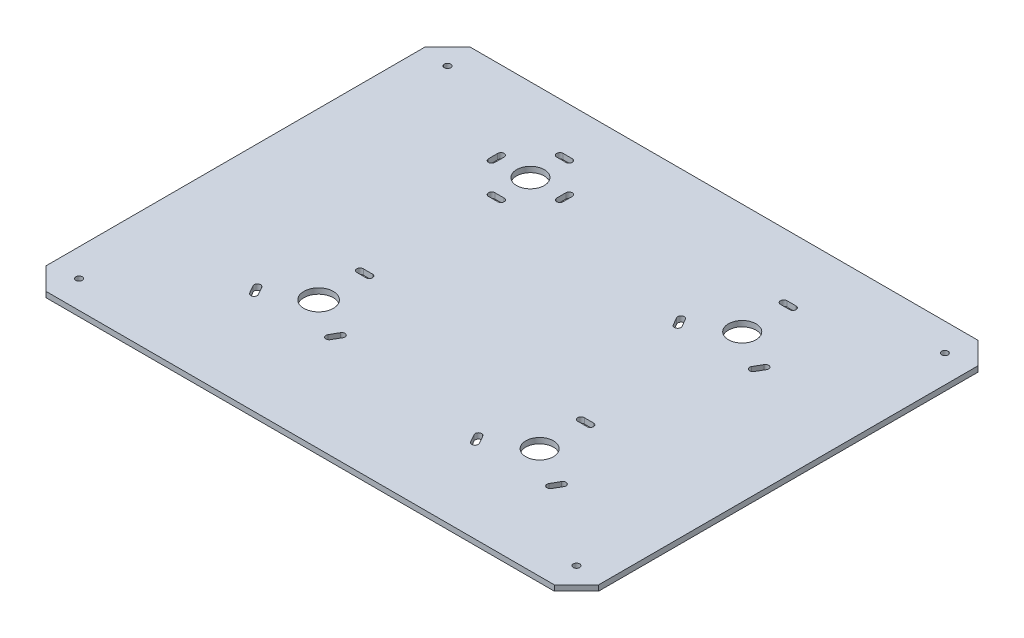
from build123d import *

# Parameters (mm, degrees)
ESBO_O1_W                 = 300
ESBO_O1_H                 = 230
RESSALTO_EXTRUS_O1_DEPTH  = 3
CHANFRO1_SIZE             = 12
ESBO_O4_R                 = 8
ESBO_O4_R_2               = 7.5
CORTE_EXTRUS_O1_DEPTH     = 190.034388406
ESBO_O5_R                 = 1.75
CORTE_EXTRUS_O2_DEPTH     = 190.034388406
ESPELHAR2_COPY_1_SKETCH_R = 1.75
ESPELHAR2_COPY_1_DEPTH    = 190.034388406


with BuildPart() as part:
    # Esboço1 → Ressalto-extrusão1 (new body)
    with BuildSketch(Plane(origin=(0, 0, 0), x_dir=(1, 0, 0), z_dir=(0, 1, 0))):
        Rectangle(ESBO_O1_W, ESBO_O1_H)
    extrude(amount=-RESSALTO_EXTRUS_O1_DEPTH)

    # Chanfro1
    chanfro1_edges = [part.edges().sort_by_distance(p)[0] for p in [
        (150, -1.5, 115),
        (-150, -1.5, 115),
        (-150, -1.5, -115),
        (150, -1.5, -115),
    ]]
    chamfer(chanfro1_edges, length=CHANFRO1_SIZE)

    # Esboço4 → Corte-extrusão1 (cut, through all)
    with BuildSketch(Plane(origin=(0, 0, 0), x_dir=(1, 0, 0), z_dir=(0, 1, 0))):
        with Locations(Location((-60, -45, 0), (0, 0, 270))):
            Circle(ESBO_O4_R)
        with Locations(Location((70, -55, 0), (0, 0, 270))):
            Circle(ESBO_O4_R_2)
        with Locations(Location((70, 55, 0), (0, 0, 270))):
            Circle(ESBO_O4_R_2)
        with Locations(Location((-60, 70, 0), (0, 0, 270))):
            Circle(ESBO_O4_R_2)
        with BuildLine():
            Line((-62.5, -21.75), (-57.5, -21.75))
            ThreePointArc((-57.5, -21.75), (-55.75, -20), (-57.5, -18.25))
            Line((-57.5, -18.25), (-62.5, -18.25))
            ThreePointArc((-62.5, -18.25), (-64.25, -20), (-62.5, -21.75))
        make_face()
        with BuildLine():
            Line((-38.614909362, -54.459936491), (-41.114909362, -58.790063509))
            ThreePointArc((-41.114909362, -58.790063509), (-40.474364905, -61.180607966), (-38.083820449, -60.540063509))
            Line((-38.083820449, -60.540063509), (-35.583820449, -56.209936491))
            ThreePointArc((-35.583820449, -56.209936491), (-36.224364905, -53.819392034), (-38.614909362, -54.459936491))
        make_face()
        with BuildLine():
            Line((-78.885090638, -58.790063509), (-81.385090638, -54.459936491))
            ThreePointArc((-81.385090638, -54.459936491), (-83.775635095, -53.819392034), (-84.416179551, -56.209936491))
            Line((-84.416179551, -56.209936491), (-81.916179551, -60.540063509))
            ThreePointArc((-81.916179551, -60.540063509), (-79.525635095, -61.180607966), (-78.885090638, -58.790063509))
        make_face()
        with BuildLine():
            Line((67.5, -28.25), (72.5, -28.25))
            ThreePointArc((72.5, -28.25), (74.25, -30), (72.5, -31.75))
            Line((72.5, -31.75), (67.5, -31.75))
            ThreePointArc((67.5, -31.75), (65.75, -30), (67.5, -28.25))
        make_face()
        with BuildLine():
            Line((91.385090638, -64.459936491), (88.885090638, -68.790063509))
            ThreePointArc((88.885090638, -68.790063509), (89.525635095, -71.180607966), (91.916179551, -70.540063509))
            Line((91.916179551, -70.540063509), (94.416179551, -66.209936491))
            ThreePointArc((94.416179551, -66.209936491), (93.775635095, -63.819392034), (91.385090638, -64.459936491))
        make_face()
        with BuildLine():
            Line((51.114909362, -68.790063509), (48.614909362, -64.459936491))
            ThreePointArc((48.614909362, -64.459936491), (46.224364905, -63.819392034), (45.583820449, -66.209936491))
            Line((45.583820449, -66.209936491), (48.083820449, -70.540063509))
            ThreePointArc((48.083820449, -70.540063509), (50.474364905, -71.180607966), (51.114909362, -68.790063509))
        make_face()
        with BuildLine():
            Line((67.5, 81.75), (72.5, 81.75))
            ThreePointArc((72.5, 81.75), (74.25, 80), (72.5, 78.25))
            Line((72.5, 78.25), (67.5, 78.25))
            ThreePointArc((67.5, 78.25), (65.75, 80), (67.5, 81.75))
        make_face()
        with BuildLine():
            Line((91.385090638, 45.540063509), (88.885090638, 41.209936491))
            ThreePointArc((88.885090638, 41.209936491), (89.525635095, 38.819392034), (91.916179551, 39.459936491))
            Line((91.916179551, 39.459936491), (94.416179551, 43.790063509))
            ThreePointArc((94.416179551, 43.790063509), (93.775635095, 46.180607966), (91.385090638, 45.540063509))
        make_face()
        with BuildLine():
            Line((51.114909362, 41.209936491), (48.614909362, 45.540063509))
            ThreePointArc((48.614909362, 45.540063509), (46.224364905, 46.180607966), (45.583820449, 43.790063509))
            Line((45.583820449, 43.790063509), (48.083820449, 39.459936491))
            ThreePointArc((48.083820449, 39.459936491), (50.474364905, 38.819392034), (51.114909362, 41.209936491))
        make_face()
        with BuildLine():
            Line((-62.5, 86.75), (-57.5, 86.75))
            ThreePointArc((-57.5, 86.75), (-55.75, 88.5), (-57.5, 90.25))
            Line((-57.5, 90.25), (-62.5, 90.25))
            ThreePointArc((-62.5, 90.25), (-64.25, 88.5), (-62.5, 86.75))
        make_face()
        with BuildLine():
            Line((-43.25, 72.5), (-43.25, 67.5))
            ThreePointArc((-43.25, 67.5), (-41.5, 65.75), (-39.75, 67.5))
            Line((-39.75, 67.5), (-39.75, 72.5))
            ThreePointArc((-39.75, 72.5), (-41.5, 74.25), (-43.25, 72.5))
        make_face()
        with BuildLine():
            Line((-57.5, 53.25), (-62.5, 53.25))
            ThreePointArc((-62.5, 53.25), (-64.25, 51.5), (-62.5, 49.75))
            Line((-62.5, 49.75), (-57.5, 49.75))
            ThreePointArc((-57.5, 49.75), (-55.75, 51.5), (-57.5, 53.25))
        make_face()
        with BuildLine():
            Line((-76.75, 67.5), (-76.75, 72.5))
            ThreePointArc((-76.75, 72.5), (-78.5, 74.25), (-80.25, 72.5))
            Line((-80.25, 72.5), (-80.25, 67.5))
            ThreePointArc((-80.25, 67.5), (-78.5, 65.75), (-76.75, 67.5))
        make_face()
    extrude(amount=-CORTE_EXTRUS_O1_DEPTH, mode=Mode.SUBTRACT)

    # Esboço5 → Corte-extrusão2 (cut, through all)
    with BuildSketch(Plane(origin=(0, 0, 0), x_dir=(1, 0, 0), z_dir=(0, 1, 0))):
        with Locations(Location((-135, -100, 0), (0, 0, 270))):
            Circle(ESBO_O5_R)
    corte_extrus_o2 = extrude(amount=-CORTE_EXTRUS_O2_DEPTH, mode=Mode.SUBTRACT)

    # Espelhar1: Corte-extrusão2 across plane
    add(corte_extrus_o2.mirror(Plane.XY), mode=Mode.SUBTRACT)

    # Espelhar2: Corte-extrusão2 across plane
    add(corte_extrus_o2.mirror(Plane(origin=(0, 0, 0), x_dir=(0, 0, 1), z_dir=(1, 0, 0))), mode=Mode.SUBTRACT)

    # Espelhar2 copy 1 sketch → Espelhar2 copy 1 (cut, through all)
    with BuildSketch(Plane(origin=(0, 0, 0), x_dir=(-1, 0, 0), z_dir=(0, 1, 0))):
        with Locations(Location((-135, -100, 0), (0, 0, 270))):
            Circle(ESPELHAR2_COPY_1_SKETCH_R)
    extrude(amount=-ESPELHAR2_COPY_1_DEPTH, mode=Mode.SUBTRACT)


solid = part.part
